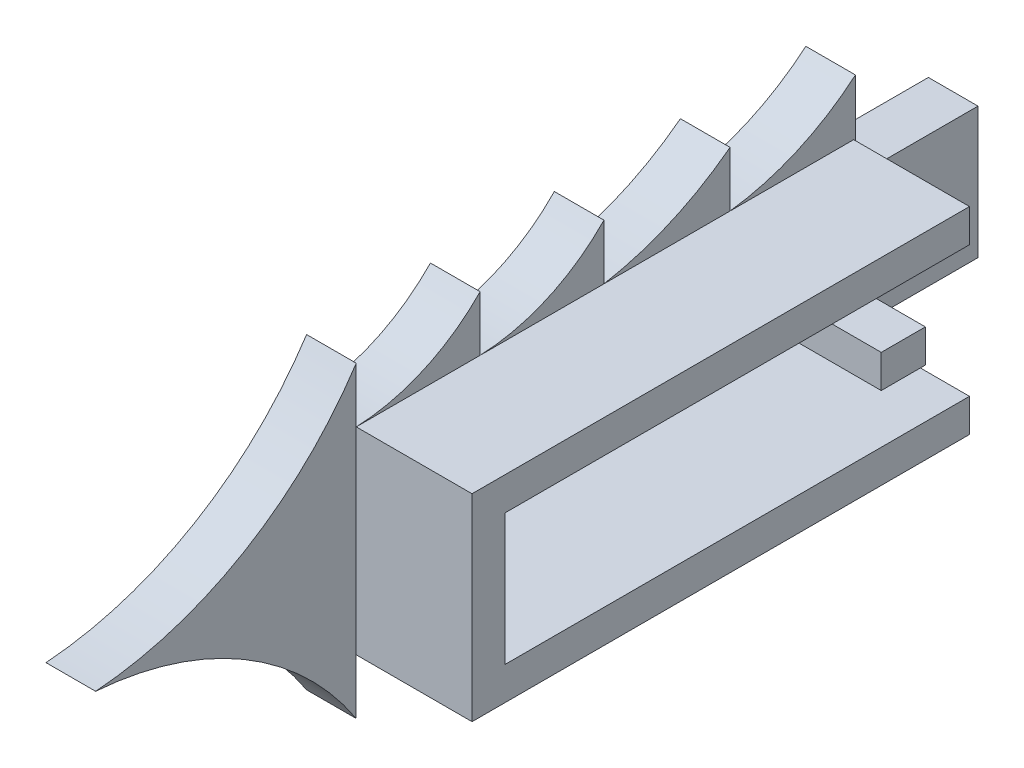
from build123d import *

# Parameters (mm, degrees)
SKETCH1_W           = 3
SKETCH1_H           = 42.1
SKETCH1_H_2         = 4
BOSS_EXTRUDE1_DEPTH = 12
SKETCH3_W           = 45.1
SKETCH3_H           = 17.9
SKETCH3_R           = 1.5
BOSS_EXTRUDE2_DEPTH = 3
SKETCH5_W           = 17.9
SKETCH5_H           = 45.1
BOSS_EXTRUDE4_DEPTH = 4.5
CUT_EXTRUDE4_DEPTH  = 54.638254019


with BuildPart() as part:
    # Sketch1 → Boss-Extrude1 (new body)
    with BuildSketch(Plane.YZ):
        Polygon((-5.95, 3.8), (5.95, 3.8), (8.95, 3.8), (8.95, 6.8), (-8.95, 6.8), (-8.95, 3.8), align=None)
        with Locations((-7.45, -17.25)):
            Rectangle(SKETCH1_W, SKETCH1_H)
        with Locations((7.45, -17.25)):
            Rectangle(SKETCH1_W, SKETCH1_H)
        with Locations((0, -32.3)):
            Rectangle(SKETCH1_W, SKETCH1_H_2)
    extrude(amount=BOSS_EXTRUDE1_DEPTH)

    # Sketch3 → Boss-Extrude2 (add)
    with BuildSketch(Plane.ZY):
        with Locations((-15.75, 0)):
            Rectangle(SKETCH3_W, SKETCH3_H)
        Circle(SKETCH3_R, mode=Mode.SUBTRACT)
    extrude(amount=BOSS_EXTRUDE2_DEPTH)

    # Sketch5 → Boss-Extrude4 (add)
    with BuildSketch(Plane(origin=(-3, 0, 0), x_dir=(0, -1, 0), z_dir=(-1, 0, 0))):
        Polygon((-13.95, 21.583539772), (-13.95, -49.572772711), (13.95, -49.572772711), (13.95, 20.927227289), (13.95, 30.427227289), (-13.95, 30.427227289), align=None)
        with Locations((0, -15.75)):
            Rectangle(SKETCH5_W, SKETCH5_H, mode=Mode.SUBTRACT)
    extrude(amount=-BOSS_EXTRUDE4_DEPTH)

    # Sketch6 → Cut-Extrude4 (cut, symmetric)
    with BuildSketch(Plane(origin=(-3, 0, 0), x_dir=(0, -1, 0), z_dir=(-1, 0, 0))):
        with BuildLine():
            Line((-8.95, -4.430558852), (-13.95, -4.430558852))
            ThreePointArc((-13.95, -4.430558852), (-10.365862707, 0.702047669), (-8.95, 6.8))
            Line((-8.95, 6.8), (-13.95, 6.8))
            ThreePointArc((-13.95, 6.8), (-4.216827043, 16.985131712), (0, 30.427227289))
            Line((0, 30.427227289), (0, 38.207310194))
            Line((0, 38.207310194), (-27.495186948, 38.207310194))
            Line((-27.495186948, 38.207310194), (-27.495186948, -49.572772711))
            Line((-27.495186948, -49.572772711), (-5.95, -49.572772711))
            Line((-5.95, -49.572772711), (-5.95, -38.463062756))
            Line((-5.95, -38.463062756), (-13.95, -38.463062756))
            ThreePointArc((-13.95, -38.463062756), (-10.621066319, -33.1423359), (-8.95, -27.092586229))
            Line((-8.95, -27.092586229), (-13.95, -27.092586229))
            ThreePointArc((-13.95, -27.092586229), (-10.764093377, -21.676860063), (-8.95, -15.661117704))
            Line((-8.95, -15.661117704), (-13.95, -15.661117704))
            ThreePointArc((-13.95, -15.661117704), (-10.365862707, -10.528511183), (-8.95, -4.430558852))
        make_face()
    cut_extrude4 = extrude(amount=CUT_EXTRUDE4_DEPTH, both=True, mode=Mode.SUBTRACT)

    # Mirror1: Cut-Extrude4 across plane
    add(cut_extrude4.mirror(Plane.ZX), mode=Mode.SUBTRACT)


solid = part.part
